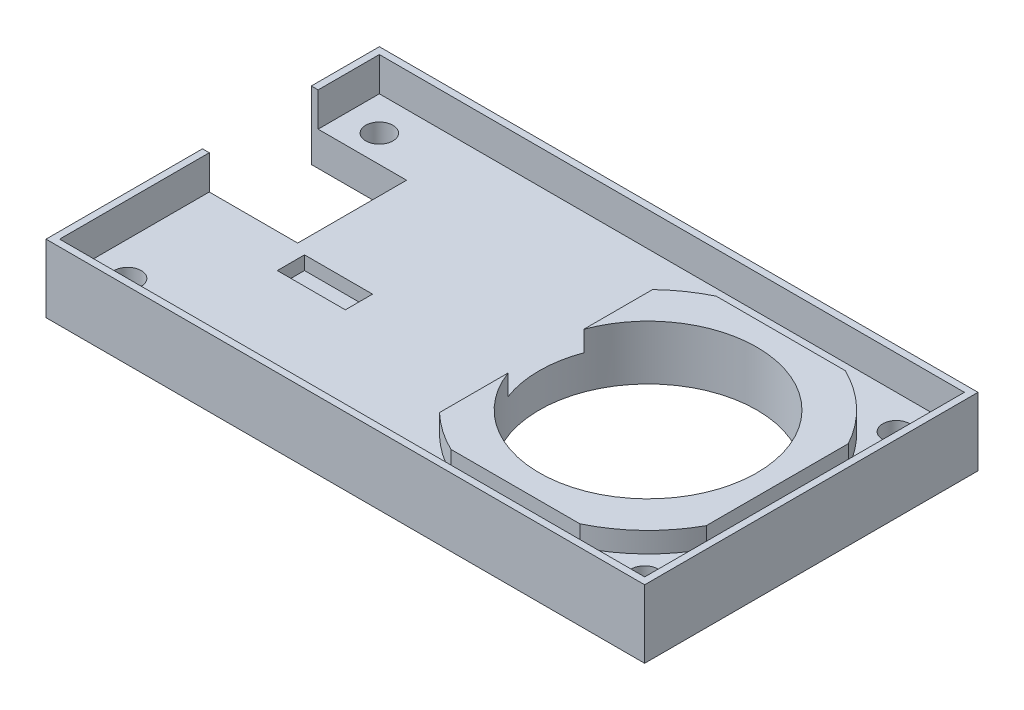
from build123d import *

# Parameters (mm, degrees)
SKETCH1_W           = 88
SKETCH1_H           = 49
BOSS_EXTRUDE1_DEPTH = 5
SKETCH2_W           = 88
SKETCH2_H           = 49
SKETCH2_W_2         = 86
SKETCH2_H_2         = 47
BOSS_EXTRUDE2_DEPTH = 5
SKETCH3_R           = 16
CUT_EXTRUDE1_DEPTH  = 5
CUT_EXTRUDE2_START  = -10
SKETCH4_W           = 14
SKETCH4_H           = 16
CUT_EXTRUDE2_DEPTH  = 10
SKETCH5_W           = 10
SKETCH5_H           = 4
CUT_EXTRUDE3_DEPTH  = 2
SKETCH6_R           = 21.682235108
SKETCH6_R_2         = 16
BOSS_EXTRUDE3_DEPTH = 3
SKETCH7_W           = 10
SKETCH7_H           = 35.531306717
CUT_EXTRUDE4_DEPTH  = 3
SKETCH8_R           = 2
CUT_EXTRUDE5_DEPTH  = 5
SKETCH9_W           = 40.675164953
SKETCH9_H           = 47
SKETCH9_W_2         = 34.982420928
SKETCH9_H_2         = 39
CUT_EXTRUDE6_DEPTH  = 3


with BuildPart() as part:
    # Sketch1 → Boss-Extrude1 (new body)
    with BuildSketch(Plane(origin=(0, 0, 0), x_dir=(1, 0, 0), z_dir=(0, 1, 0))):
        with Locations((44, 24.5)):
            Rectangle(SKETCH1_W, SKETCH1_H)
    extrude(amount=BOSS_EXTRUDE1_DEPTH)

    # Sketch2 → Boss-Extrude2 (add)
    with BuildSketch(Plane(origin=(0, 5, 0), x_dir=(1, 0, 0), z_dir=(0, 1, 0))):
        with Locations((44, 24.5)):
            Rectangle(SKETCH2_W, SKETCH2_H)
        with Locations((44, 24.5)):
            Rectangle(SKETCH2_W_2, SKETCH2_H_2, mode=Mode.SUBTRACT)
    extrude(amount=BOSS_EXTRUDE2_DEPTH)

    # Sketch3 → Cut-Extrude1 (cut)
    with BuildSketch(Plane(origin=(0, 0, 0), x_dir=(-1, 0, 0), z_dir=(0, -1, 0))):
        with Locations(Location((-64, 24.5, 0), (0, 0, 90))):
            Circle(SKETCH3_R)
    extrude(amount=-CUT_EXTRUDE1_DEPTH, mode=Mode.SUBTRACT)

    # Sketch4 → Cut-Extrude2 (cut)
    with BuildSketch(Plane.XZ.offset(CUT_EXTRUDE2_START)):
        with Locations((7, -31)):
            Rectangle(SKETCH4_W, SKETCH4_H)
    extrude(amount=CUT_EXTRUDE2_DEPTH, mode=Mode.SUBTRACT)

    # Sketch5 → Cut-Extrude3 (cut)
    with BuildSketch(Plane(origin=(0, 5, 0), x_dir=(1, 0, 0), z_dir=(0, 1, 0))):
        with Locations((21, 20)):
            Rectangle(SKETCH5_W, SKETCH5_H)
    extrude(amount=-CUT_EXTRUDE3_DEPTH, mode=Mode.SUBTRACT)

    # Sketch6 → Boss-Extrude3 (add)
    with BuildSketch(Plane(origin=(0, 5, 0), x_dir=(1, 0, 0), z_dir=(0, 1, 0))):
        with Locations(Location((64, 24.5, 0), (0, 0, 90))):
            Circle(SKETCH6_R)
        with Locations(Location((64, 24.5, 0), (0, 0, 90))):
            Circle(SKETCH6_R_2, mode=Mode.SUBTRACT)
    extrude(amount=BOSS_EXTRUDE3_DEPTH)

    # Sketch7 → Cut-Extrude4 (cut)
    with BuildSketch(Plane(origin=(0, 5, 0), x_dir=(1, 0, 0), z_dir=(0, 1, 0))):
        with Locations((44, 25.309726248)):
            Rectangle(SKETCH7_W, SKETCH7_H)
    extrude(amount=CUT_EXTRUDE4_DEPTH, mode=Mode.SUBTRACT)

    # Sketch8 → Cut-Extrude5 (cut)
    with BuildSketch(Plane(origin=(0, 0, 0), x_dir=(-1, 0, 0), z_dir=(0, -1, 0))):
        with Locations(Location((-82, 6, 0), (0, 0, 90))):
            Circle(SKETCH8_R)
        with Locations(Location((-6, 6, 0), (0, 0, 90))):
            Circle(SKETCH8_R)
        with Locations(Location((-6, 43, 0), (0, 0, 90))):
            Circle(SKETCH8_R)
        with Locations(Location((-82, 43, 0), (0, 0, 90))):
            Circle(SKETCH8_R)
    extrude(amount=-CUT_EXTRUDE5_DEPTH, mode=Mode.SUBTRACT)

    # Sketch9 → Cut-Extrude6 (cut)
    with BuildSketch(Plane(origin=(0, 5, 0), x_dir=(1, 0, 0), z_dir=(0, 1, 0))):
        with Locations((66.662417523, 24.5)):
            Rectangle(SKETCH9_W, SKETCH9_H)
        with Locations((65.508789536, 24.5)):
            Rectangle(SKETCH9_W_2, SKETCH9_H_2, mode=Mode.SUBTRACT)
    extrude(amount=CUT_EXTRUDE6_DEPTH, mode=Mode.SUBTRACT)


solid = part.part
